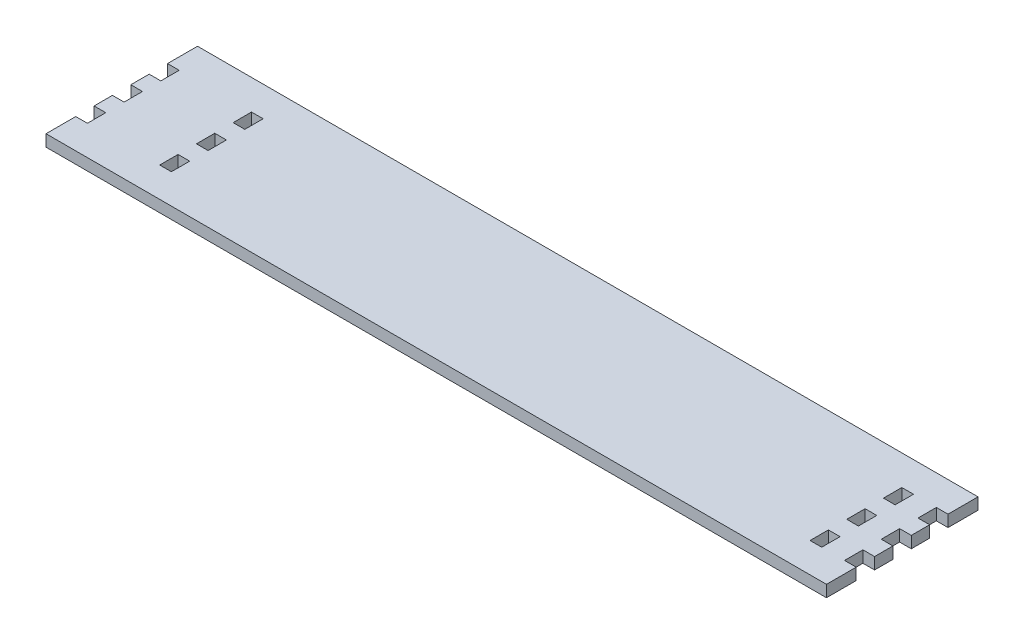
from build123d import *

# Parameters (mm, degrees)
SKETCH1_W           = 3.175
SKETCH1_H           = 5
BOSS_EXTRUDE1_DEPTH = 3.175


with BuildPart() as part:
    # Sketch1 → Boss-Extrude1 (new body)
    with BuildSketch(Plane(origin=(0, 0, 0), x_dir=(1, 0, 0), z_dir=(0, 1, 0))):
        Polygon((-212.598, -5), (-209.423, -5), (-209.423, -10), (-212.598, -10), (-212.598, -15), (-209.423, -15), (-209.423, -20), (-212.598, -20), (-212.598, -25), (-209.423, -25), (-209.423, -30), (-212.598, -30), (-212.598, -38.1), (-209.423, -38.1), (-3.175, -38.1), (0, -38.1), (0, -30), (-3.175, -30), (-3.175, -25), (0, -25), (0, -20), (-3.175, -20), (-3.175, -15), (0, -15), (0, -10), (-3.175, -10), (-3.175, -5), (0, -5), (0, 0), (0, 3.175), (-212.598, 3.175), (-212.598, 0), align=None)
        with Locations((-188.136500028, -7.5)):
            Rectangle(SKETCH1_W, SKETCH1_H, mode=Mode.SUBTRACT)
        with Locations((-188.136500028, -17.5)):
            Rectangle(SKETCH1_W, SKETCH1_H, mode=Mode.SUBTRACT)
        with Locations((-188.136500028, -27.5)):
            Rectangle(SKETCH1_W, SKETCH1_H, mode=Mode.SUBTRACT)
        with Locations((-10.9855, -27.5)):
            Rectangle(SKETCH1_W, SKETCH1_H, mode=Mode.SUBTRACT)
        with Locations((-10.9855, -17.5)):
            Rectangle(SKETCH1_W, SKETCH1_H, mode=Mode.SUBTRACT)
        with Locations((-10.9855, -7.5)):
            Rectangle(SKETCH1_W, SKETCH1_H, mode=Mode.SUBTRACT)
    extrude(amount=BOSS_EXTRUDE1_DEPTH)


solid = part.part
